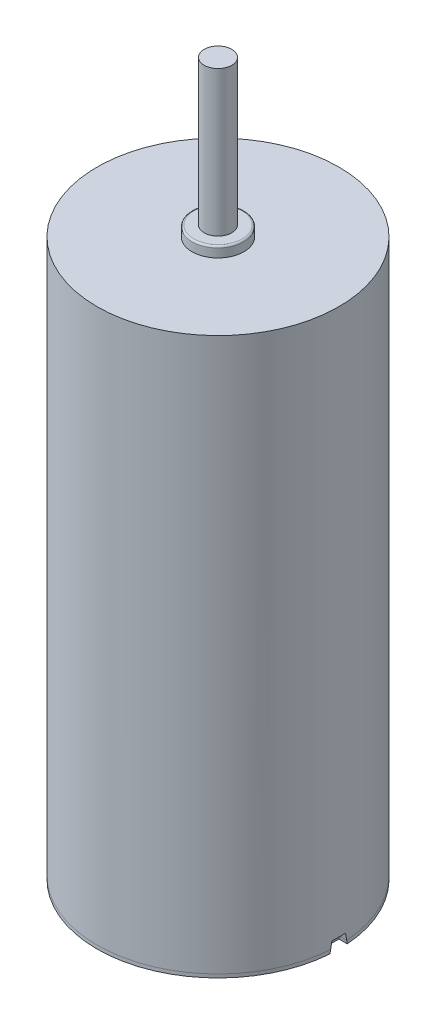
from build123d import *

# Parameters (mm, degrees)
SKETCH_1_R                    = 3.5
EXTRUDE_1_DEPTH               = 16
SKETCH_3_R                    = 0.4
EXTRUDE_2_DEPTH               = 4.5
SKETCH_4_R                    = 0.75
EXTRUDE_3_DEPTH               = 0.3
FILLET_1_R                    = 0.05
SKETCH_5_R                    = 3.5
EXTRUDE_4_DEPTH               = 0.1
SKETCH_6_W                    = 0.5
SKETCH_6_H                    = 0.5
CUT_EXTRUDE_1_DEPTH           = 0.3
CUT_EXTRUDE_1_DRAFT           = -10
CUT_EXTRUDE_1_PROFILE_2_DEPTH = 0.3
CUT_EXTRUDE_1_PROFILE_2_DRAFT = -10


with BuildPart() as part:
    # 草图1 → 凸台-拉伸1 (new body)
    with BuildSketch(Plane(origin=(0, 0, 0), x_dir=(1, 0, 0), z_dir=(0, 1, 0))):
        with Locations(Location((0, 0, 0), (0, 0, 270))):
            Circle(SKETCH_1_R)
    extrude(amount=EXTRUDE_1_DEPTH)

    # 草图3 → 凸台-拉伸2 (add)
    with BuildSketch(Plane(origin=(0, 16, 0), x_dir=(1, 0, 0), z_dir=(0, 1, 0))):
        with Locations(Location((0, 0, 0), (0, 0, 270))):
            Circle(SKETCH_3_R)
    extrude(amount=EXTRUDE_2_DEPTH)

    # 草图4 → 凸台-拉伸3 (add)
    with BuildSketch(Plane(origin=(0, 16, 0), x_dir=(1, 0, 0), z_dir=(0, 1, 0))):
        with Locations(Location((0, 0, 0), (0, 0, 270))):
            Circle(SKETCH_4_R)
    extrude(amount=EXTRUDE_3_DEPTH)

    # 圆角1
    fillet_1_edges = [part.edges().sort_by_distance(p)[0] for p in [
        (0, 16.3, -0.75),
    ]]
    fillet(fillet_1_edges, radius=FILLET_1_R)


with BuildPart() as body_2:
    # 草图5 → 凸台-拉伸4 (new body)
    with BuildSketch(Plane.XZ):
        with Locations(Location((0, 0, 0), (0, 0, 270))):
            Circle(SKETCH_5_R)
    extrude(amount=EXTRUDE_4_DEPTH)


with BuildPart() as cut_extrude_1_tool:
    # 草图6 → 切除-拉伸1 (with draft: the straight prism first)
    with BuildSketch(Plane.XZ.offset(0.1)):
        with Locations((3.5, 0)):
            Rectangle(SKETCH_6_W, SKETCH_6_H)
    extrude(amount=-CUT_EXTRUDE_1_DEPTH)
    # 切除-拉伸1: the draft: its side faces are tilted about the plane it starts from
    cut_extrude_1_sides = [cut_extrude_1_tool.faces().sort_by_distance(p)[0] for p in [
        (3.5, 0.05, 0.25),
        (3.25, 0.05, 0),
        (3.5, 0.05, -0.25),
        (3.75, 0.05, 0),
    ]]
    draft(cut_extrude_1_sides, Plane.XZ.offset(0.1), CUT_EXTRUDE_1_DRAFT)


with BuildPart() as part_1:
    add(part.part)

    # 切除-拉伸1: cut by cut_extrude_1_tool
    add(cut_extrude_1_tool.part, mode=Mode.SUBTRACT)


with BuildPart() as body_2_1:
    add(body_2.part)

    # 切除-拉伸1: cut by cut_extrude_1_tool
    add(cut_extrude_1_tool.part, mode=Mode.SUBTRACT)


with BuildPart() as cut_extrude_1_profile_2_tool:
    # 草图6 → 切除-拉伸1 profile 2 (with draft: the straight prism first)
    with BuildSketch(Plane.XZ.offset(0.1)):
        with Locations((-3.5, 0)):
            Rectangle(SKETCH_6_W, SKETCH_6_H)
    extrude(amount=-CUT_EXTRUDE_1_PROFILE_2_DEPTH)
    # 切除-拉伸1 profile 2: the draft: its side faces are tilted about the plane it starts from
    cut_extrude_1_profile_2_sides = [cut_extrude_1_profile_2_tool.faces().sort_by_distance(p)[0] for p in [
        (-3.5, 0.05, 0.25),
        (-3.75, 0.05, 0),
        (-3.5, 0.05, -0.25),
        (-3.25, 0.05, 0),
    ]]
    draft(cut_extrude_1_profile_2_sides, Plane.XZ.offset(0.1), CUT_EXTRUDE_1_PROFILE_2_DRAFT)


with BuildPart() as part_2:
    add(part_1.part)

    # 切除-拉伸1 profile 2: cut by cut_extrude_1_profile_2_tool
    add(cut_extrude_1_profile_2_tool.part, mode=Mode.SUBTRACT)


with BuildPart() as body_2_2:
    add(body_2_1.part)

    # 切除-拉伸1 profile 2: cut by cut_extrude_1_profile_2_tool
    add(cut_extrude_1_profile_2_tool.part, mode=Mode.SUBTRACT)


solid = Compound([part_2.part, body_2_2.part])
